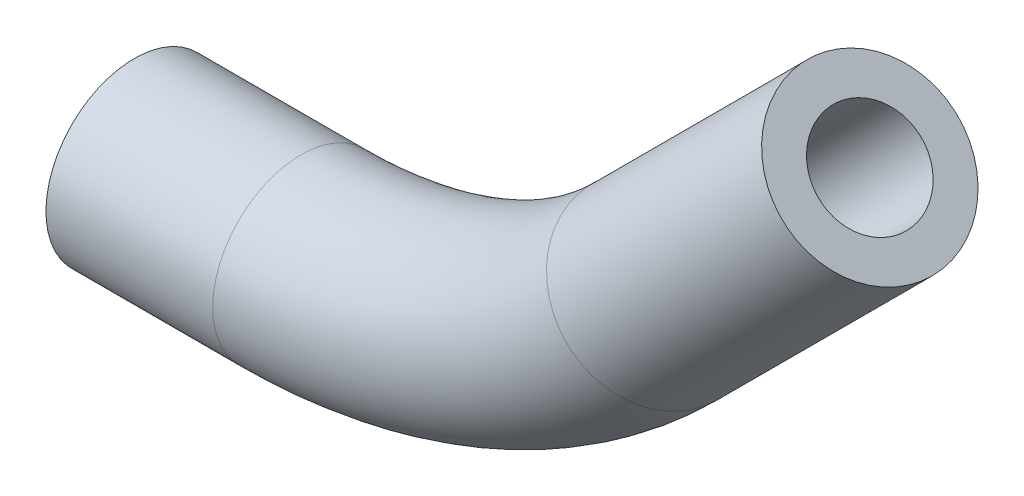
from build123d import *

# Parameters (mm, degrees)
SWEEP1_PROFILE_R     = 13.462
CUT_SWEEP1_PROFILE_R = 7.874


with BuildPart() as part:
    # Sweep1: sweep along a path in Sketch1
    with BuildLine(Plane.XY) as sweep1_path:
        Line((0, 0), (25.4, 0))
        ThreePointArc((25.4, 0), (54.560477546, 5.800379623), (79.281536726, 22.318463274))
        Line((79.281536726, 22.318463274), (112.048522617, 55.085449164))
    # Sweep1 profile (on start of the path) → Sweep1 (sweep)
    with BuildSketch(Plane(origin=(0, 0, 0), x_dir=(0, 0, 1), z_dir=(1, 0, 0))):
        Circle(SWEEP1_PROFILE_R)
    sweep(path=sweep1_path.line)

    # Cut-Sweep1: sweep along a path in Sketch1<2>
    with BuildLine(Plane.XY) as cut_sweep1_path:
        Line((0, 0), (25.4, 0))
        ThreePointArc((25.4, 0), (54.560477546, 5.800379623), (79.281536726, 22.318463274))
        Line((79.281536726, 22.318463274), (112.048522617, 55.085449164))
    # Cut-Sweep1 profile (on start of the path) → Cut-Sweep1 (sweep, cut)
    with BuildSketch(Plane(origin=(0, 0, 0), x_dir=(0, 0, 1), z_dir=(1, 0, 0))):
        Circle(CUT_SWEEP1_PROFILE_R)
    sweep(path=cut_sweep1_path.line, mode=Mode.SUBTRACT)


solid = part.part
